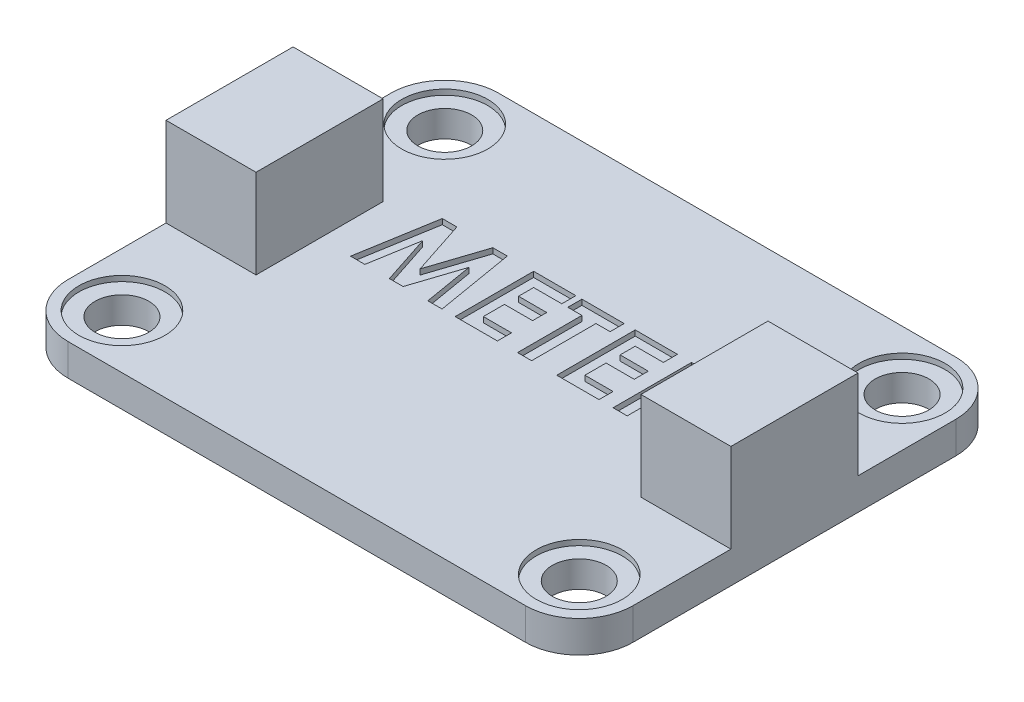
from build123d import *

# Parameters (mm, degrees)
SKETCH1_W           = 26.67
SKETCH1_H           = 20.32
BOSS_EXTRUDE1_DEPTH = 1.5
SKETCH2_R           = 1.27
CUT_EXTRUDE1_DEPTH  = 17.831453443
FILLET1_R           = 2.54
CUT_EXTRUDE2_DEPTH  = 0.254
SKETCH4_R           = 2.032
SKETCH4_R_2         = 1.27
CUT_EXTRUDE3_DEPTH  = 0.254
SKETCH5_W           = 4.25
SKETCH5_H           = 6
BOSS_EXTRUDE3_DEPTH = 4.2


with BuildPart() as part:
    # Sketch1 → Boss-Extrude1 (new body)
    with BuildSketch(Plane(origin=(0, 0, 0), x_dir=(1, 0, 0), z_dir=(0, 1, 0))):
        Rectangle(SKETCH1_W, SKETCH1_H)
    extrude(amount=BOSS_EXTRUDE1_DEPTH)

    # Sketch2 → Cut-Extrude1 (cut, through all)
    with BuildSketch(Plane(origin=(0, 1.5, 0), x_dir=(1, 0, 0), z_dir=(0, 1, 0))):
        with Locations(Location((10.795, 7.62, 0), (0, 0, 270))):
            Circle(SKETCH2_R)
        with Locations(Location((-10.795, 7.62, 0), (0, 0, 270))):
            Circle(SKETCH2_R)
        with Locations(Location((-10.795, -7.62, 0), (0, 0, 270))):
            Circle(SKETCH2_R)
        with Locations(Location((10.795, -7.62, 0), (0, 0, 270))):
            Circle(SKETCH2_R)
    extrude(amount=-CUT_EXTRUDE1_DEPTH, mode=Mode.SUBTRACT)

    # Fillet1
    fillet1_edges = [part.edges().sort_by_distance(p)[0] for p in [
        (13.335, 0.75, 10.16),
        (-13.335, 0.75, 10.16),
        (-13.335, 0.75, -10.16),
        (13.335, 0.75, -10.16),
    ]]
    fillet(fillet1_edges, radius=FILLET1_R)

    # Sketch3 → Cut-Extrude2 (cut)
    # profile 1 of 5: a face of its own
    with BuildSketch(Plane(origin=(0, 1.5, 0), x_dir=(1, 0, 0), z_dir=(0, 1, 0))):
        Polygon((-6.996511919, 3.704166667), (-6.306432792, 3.704166667), (-5.461271368, 1.120451055), (-4.610173778, 3.704166667), (-3.926772837, 3.704166667), (-3.300507479, 0), (-3.973520132, 0), (-4.369017094, 2.339590845), (-5.139234442, 0), (-5.787760417, 0), (-6.553525641, 2.339590845), (-6.948280582, 0), (-7.622035256, 0), align=None)
    # profile 2 of 5: a face of its own
    with BuildSketch(Plane(origin=(0, 1.5, 0), x_dir=(1, 0, 0), z_dir=(0, 1, 0))):
        Polygon((-2.683146368, 3.704166667), (-0.688595085, 3.704166667), (-0.688595085, 3.039316239), (-2.01829594, 3.039316239), (-2.01829594, 2.326976496), (-0.688595085, 2.326976496), (-0.688595085, 1.662126068), (-2.01829594, 1.662126068), (-2.01829594, 0.664850427), (-0.688595085, 0.664850427), (-0.688595085, 0), (-2.683146368, 0), align=None)
    # profile 3 of 5: a face of its own
    with BuildSketch(Plane(origin=(0, 1.5, 0), x_dir=(1, 0, 0), z_dir=(0, 1, 0))):
        Polygon((-0.403659188, 3.704166667), (1.590892094, 3.704166667), (1.590892094, 3.039316239), (0.926041667, 3.039316239), (0.926041667, 0), (0.261191239, 0), (0.261191239, 3.039316239), (-0.403659188, 3.039316239), align=None)
    # profile 4 of 5: a face of its own
    with BuildSketch(Plane(origin=(0, 1.5, 0), x_dir=(1, 0, 0), z_dir=(0, 1, 0))):
        Polygon((2.113274573, 3.704166667), (4.107825855, 3.704166667), (4.107825855, 3.039316239), (2.778125, 3.039316239), (2.778125, 2.326976496), (4.107825855, 2.326976496), (4.107825855, 1.662126068), (2.778125, 1.662126068), (2.778125, 0.664850427), (4.107825855, 0.664850427), (4.107825855, 0), (2.113274573, 0), align=None)
    # profile 5 of 5: a face of its own
    with BuildSketch(Plane(origin=(0, 1.5, 0), x_dir=(1, 0, 0), z_dir=(0, 1, 0))):
        with BuildLine():
            Line((4.772676282, 3.704166667), (5.547345753, 3.704166667))
            add(Edge.make_bspline(
                [(5.547345753, 3.704166667), (5.598551169, 3.703984917), (5.697033609, 3.703635361), (5.839039907, 3.698120291), (5.969492221, 3.690445618), (6.088583697, 3.678733864), (6.196263387, 3.663205494), (6.292639209, 3.644900116), (6.377708347, 3.624037212), (6.452188242, 3.598040388), (6.519402665, 3.568716365), (6.582055851, 3.535022525), (6.641530024, 3.497334059), (6.697427662, 3.454659282), (6.75023453, 3.407765903), (6.800050251, 3.356606718), (6.846170881, 3.30074792), (6.888310842, 3.240542464), (6.926718023, 3.177207705), (6.960661917, 3.110656684), (6.988265147, 3.040843118), (7.01265556, 2.968775966), (7.030223185, 2.893425013), (7.04244121, 2.815523813), (7.051386771, 2.734798146), (7.051901098, 2.679956711), (7.052163462, 2.651981504)],
                knots=[0, 0, 0, 0, 1.749336639, 3.364467119, 4.854658419, 6.213483162, 7.451590619, 8.570285859, 9.5643256, 10.440900261, 11.26203566, 12.067320669, 12.869050712, 13.665104639, 14.467235401, 15.27997916, 16.102287765, 16.939272006, 17.78853747, 18.631303466, 19.488103222, 20.351255419, 21.228522269, 22.127379805, 23.044756219, 24, 24, 24, 24], degree=3))
            add(Edge.make_bspline(
                [(7.052163462, 2.651981504), (7.051481935, 2.622781813), (7.050145585, 2.565526543), (7.04294728, 2.481423219), (7.029791039, 2.400959043), (7.009863997, 2.324369601), (6.986960451, 2.250701651), (6.95650461, 2.18131441), (6.922132184, 2.115198744), (6.881309057, 2.053289882), (6.83650767, 1.994212705), (6.784404599, 1.940230679), (6.728375323, 1.888442475), (6.665270232, 1.842091929), (6.597871057, 1.798044986), (6.524838649, 1.758126726), (6.44664964, 1.721333695), (6.391678895, 1.700815359), (6.363568376, 1.69032285)],
                knots=[0, 0, 0, 0, 1.099860209, 2.156625411, 3.176576793, 4.16617041, 5.135385252, 6.078461593, 7.016046972, 7.938469504, 8.868247731, 9.803980173, 10.76021508, 11.73834243, 12.748633912, 13.790971185, 14.870363756, 16, 16, 16, 16], degree=3))
            Line((6.363568376, 1.69032285), (7.218376068, 0))
            Line((7.218376068, 0), (6.479323584, 0))
            Line((6.479323584, 0), (5.663100962, 1.614636752))
            Line((5.663100962, 1.614636752), (5.437526709, 1.614636752))
            Line((5.437526709, 1.614636752), (5.437526709, 0))
            Line((5.437526709, 0), (4.772676282, 0))
            Line((4.772676282, 0), (4.772676282, 3.704166667))
        make_face()
        with BuildLine():
            Line((5.437526709, 2.279487179), (5.696491887, 2.279487179))
            add(Edge.make_bspline(
                [(5.696491887, 2.279487179), (5.728152533, 2.279843763), (5.788775866, 2.280526544), (5.875960182, 2.283693564), (5.955144333, 2.291324517), (6.026668362, 2.300965941), (6.090892173, 2.312098358), (6.147242912, 2.328051787), (6.196588856, 2.34514629), (6.238345256, 2.366390323), (6.274020965, 2.390549396), (6.304824656, 2.417994704), (6.330303725, 2.449759153), (6.351274298, 2.484979522), (6.367587124, 2.523967328), (6.379494238, 2.566294572), (6.386148553, 2.612443416), (6.386914155, 2.644292402), (6.387313034, 2.660885751)],
                knots=[0, 0, 0, 0, 1.688639943, 3.233382647, 4.650958383, 5.928841754, 7.082724185, 8.122798841, 9.049171256, 9.863274652, 10.613301712, 11.341792392, 12.054588806, 12.776240173, 13.521029143, 14.301969904, 15.115324896, 16, 16, 16, 16], degree=3))
            add(Edge.make_bspline(
                [(6.387313034, 2.660885751), (6.386558917, 2.680516893), (6.385077593, 2.719078635), (6.370378255, 2.774594022), (6.346980086, 2.825977311), (6.314907604, 2.872996339), (6.274516483, 2.914216465), (6.228164484, 2.950552334), (6.174851221, 2.979284021), (6.125487151, 2.998235136), (6.080577385, 3.009573783), (6.040047739, 3.018023243), (5.993114165, 3.024011617), (5.93974123, 3.030363355), (5.880064984, 3.034482135), (5.813760155, 3.037488023), (5.741017172, 3.03871788), (5.690308404, 3.039111043), (5.663842982, 3.039316239)],
                knots=[0, 0, 0, 0, 1.020303359, 2.004196876, 2.966617323, 3.9489082, 4.950758222, 5.960522915, 7.003732012, 8.091992268, 8.70421221, 9.413913587, 10.24622431, 11.166358409, 12.212345909, 13.359657661, 14.621978493, 16, 16, 16, 16], degree=3))
            Line((5.663842982, 3.039316239), (5.437526709, 3.039316239))
            Line((5.437526709, 3.039316239), (5.437526709, 2.279487179))
        make_face(mode=Mode.SUBTRACT)
    extrude(amount=-CUT_EXTRUDE2_DEPTH, mode=Mode.SUBTRACT)

    # Sketch4 → Cut-Extrude3 (cut)
    # profile 1 of 4: a face of its own
    with BuildSketch(Plane(origin=(0, 1.5, 0), x_dir=(1, 0, 0), z_dir=(0, 1, 0))):
        with Locations(Location((-10.795, 7.62, 0), (0, 0, 270))):
            Circle(SKETCH4_R)
        with Locations(Location((-10.795, 7.62, 0), (0, 0, 270))):
            Circle(SKETCH4_R_2, mode=Mode.SUBTRACT)
    # profile 2 of 4: a face of its own
    with BuildSketch(Plane(origin=(0, 1.5, 0), x_dir=(1, 0, 0), z_dir=(0, 1, 0))):
        with Locations(Location((10.795, 7.62, 0), (0, 0, 270))):
            Circle(SKETCH4_R)
        with Locations(Location((10.795, 7.62, 0), (0, 0, 270))):
            Circle(SKETCH4_R_2, mode=Mode.SUBTRACT)
    # profile 3 of 4: a face of its own
    with BuildSketch(Plane(origin=(0, 1.5, 0), x_dir=(1, 0, 0), z_dir=(0, 1, 0))):
        with Locations(Location((10.795, -7.62, 0), (0, 0, 270))):
            Circle(SKETCH4_R)
        with Locations(Location((10.795, -7.62, 0), (0, 0, 270))):
            Circle(SKETCH4_R_2, mode=Mode.SUBTRACT)
    # profile 4 of 4: a face of its own
    with BuildSketch(Plane(origin=(0, 1.5, 0), x_dir=(1, 0, 0), z_dir=(0, 1, 0))):
        with Locations(Location((-10.795, -7.62, 0), (0, 0, 270))):
            Circle(SKETCH4_R)
        with Locations(Location((-10.795, -7.62, 0), (0, 0, 270))):
            Circle(SKETCH4_R_2, mode=Mode.SUBTRACT)
    extrude(amount=-CUT_EXTRUDE3_DEPTH, mode=Mode.SUBTRACT)

    # Sketch5 → Boss-Extrude3 (add)
    with BuildSketch(Plane(origin=(0, 1.5, 0), x_dir=(1, 0, 0), z_dir=(0, 1, 0))):
        with Locations((-11.21, 0)):
            Rectangle(SKETCH5_W, SKETCH5_H)
        with Locations((11.21, 0)):
            Rectangle(SKETCH5_W, SKETCH5_H)
    extrude(amount=BOSS_EXTRUDE3_DEPTH)


solid = part.part
